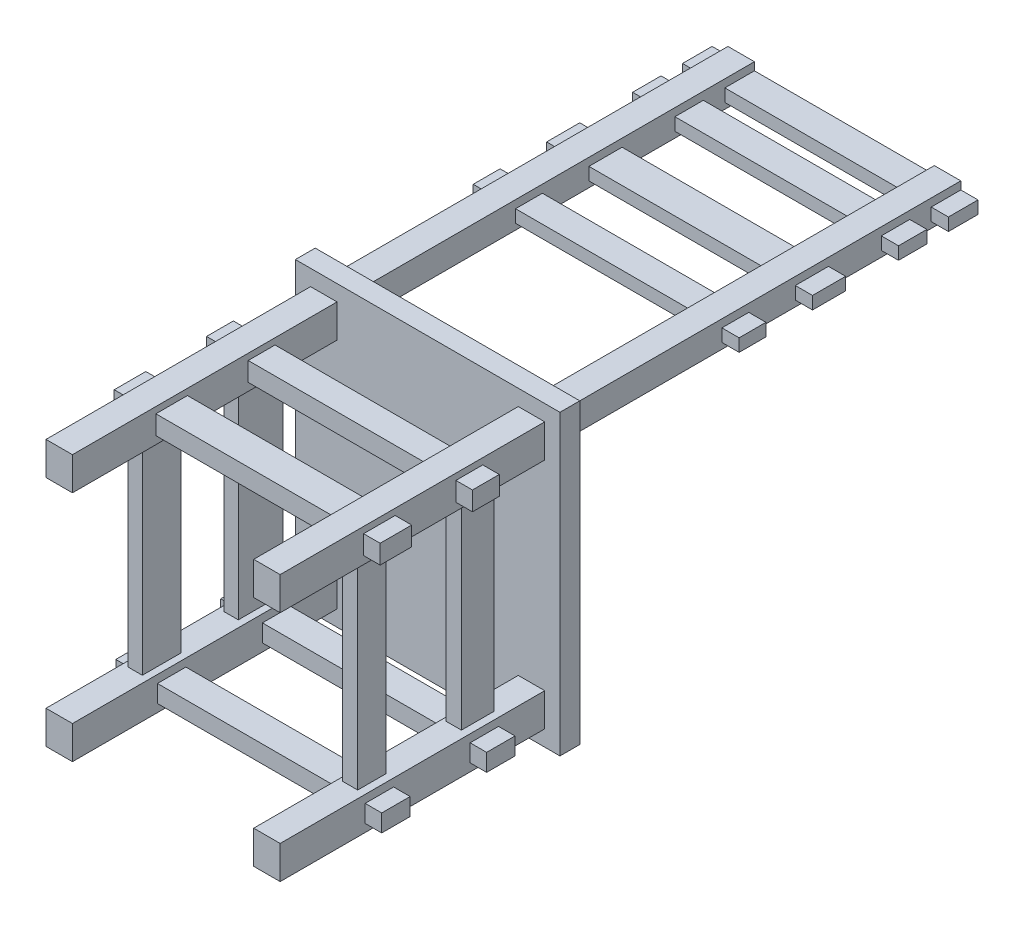
from build123d import *

# Parameters (mm, degrees)
SKETCH2_W                       = 400
SKETCH2_H                       = 450
BOSS_EXTRUDE1_DEPTH             = 30
SKETCH3_W                       = 40
SKETCH3_H                       = 50
BOSS_EXTRUDE2_DEPTH             = 400
SKETCH4_W                       = 40
SKETCH4_H                       = 40
BOSS_EXTRUDE3_DEPTH             = 600
SKETCH5_W                       = 40.556580032
SKETCH5_H                       = 28.62817414
SKETCH5_W_2                     = 47.713623567
BOSS_EXTRUDE4_DEPTH             = 402
SKETCH6_W                       = 42.94226121
SKETCH6_H                       = 26.242492962
SKETCH6_W_2                     = 42.942261211
BOSS_EXTRUDE5_DEPTH             = 402
SKETCH7_W                       = 40.556580032
SKETCH7_H                       = 19.085449427
SKETCH7_W_2                     = 50.099304746
SKETCH7_W_3                     = 42.94226121
SKETCH7_W_4                     = 44.71367334
BOSS_EXTRUDE6_DEPTH             = 402
BOSS_EXTRUDE7_REACH             = 816.236
SKETCH8_W                       = 21.611464792
SKETCH8_H                       = 67.92174649
SKETCH8_H_2                     = 58.65969015
BOSS_EXTRUDE7_DIRECTION_2_DEPTH = 2
BOSS_EXTRUDE8_REACH             = 816.236
SKETCH9_W                       = 23.109912939
SKETCH9_H                       = 42.918409744
SKETCH9_H_2                     = 49.521242012


with BuildPart() as part:
    # Sketch2 → Boss-Extrude1 (new body)
    with BuildSketch(Plane.XY):
        with Locations((200, 225)):
            Rectangle(SKETCH2_W, SKETCH2_H)
    extrude(amount=BOSS_EXTRUDE1_DEPTH)

    # Sketch3 → Boss-Extrude2 (add)
    with BuildSketch(Plane.XY.offset(30)):
        with Locations((43, 401)):
            Rectangle(SKETCH3_W, SKETCH3_H)
        with Locations((357, 401)):
            Rectangle(SKETCH3_W, SKETCH3_H)
        with Locations((357, 49)):
            Rectangle(SKETCH3_W, SKETCH3_H)
        with Locations((43, 49)):
            Rectangle(SKETCH3_W, SKETCH3_H)
    extrude(amount=BOSS_EXTRUDE2_DEPTH)

    # Sketch4 → Boss-Extrude3 (add)
    with BuildSketch(Plane(origin=(0, 0, 0), x_dir=(-1, 0, 0), z_dir=(0, 0, -1))):
        with Locations((-356, 406)):
            Rectangle(SKETCH4_W, SKETCH4_H)
        with Locations((-44, 406)):
            Rectangle(SKETCH4_W, SKETCH4_H)
    extrude(amount=BOSS_EXTRUDE3_DEPTH)

    # Sketch5 → Boss-Extrude4 (add)
    with BuildSketch(Plane(origin=(0, 0, 0), x_dir=(0, 0, -1), z_dir=(1, 0, 0))):
        with Locations((-144.025393122, 402.136827493)):
            Rectangle(SKETCH5_W, SKETCH5_H)
        with Locations((-280.009220289, 402.136827493)):
            Rectangle(SKETCH5_W_2, SKETCH5_H)
    extrude(amount=BOSS_EXTRUDE4_DEPTH)

    # Sketch6 → Boss-Extrude5 (add)
    with BuildSketch(Plane(origin=(0, 0, 0), x_dir=(0, 0, -1), z_dir=(1, 0, 0))):
        with Locations((-280.009220288, 49.056013096)):
            Rectangle(SKETCH6_W, SKETCH6_H)
        with Locations((-121.361421928, 49.056013096)):
            Rectangle(SKETCH6_W_2, SKETCH6_H)
    extrude(amount=BOSS_EXTRUDE5_DEPTH)

    # Sketch7 → Boss-Extrude6 (add)
    with BuildSketch(Plane(origin=(0, 0, 0), x_dir=(0, 0, -1), z_dir=(1, 0, 0))):
        with Locations((259.15472602, 404.522508672)):
            Rectangle(SKETCH7_W, SKETCH7_H)
        with Locations((374.86026317, 404.522508672)):
            Rectangle(SKETCH7_W_2, SKETCH7_H)
        with Locations((501.301365623, 404.522508672)):
            Rectangle(SKETCH7_W_3, SKETCH7_H)
        with Locations((577.64316333, 404.522508672)):
            Rectangle(SKETCH7_W_4, SKETCH7_H)
    extrude(amount=BOSS_EXTRUDE6_DEPTH)

    # Sketch8 → Boss-Extrude7 (add, up to next)
    with BuildSketch(Plane(origin=(0, 74, 0), x_dir=(1, 0, 0), z_dir=(0, 1, 0)), mode=Mode.PRIVATE) as boss_extrude7_sk1:
        with Locations((41.856325516, -134.973838063)):
            Rectangle(SKETCH8_W, SKETCH8_H)
    boss_extrude7_tool1 = extrude(boss_extrude7_sk1.sketch, amount=BOSS_EXTRUDE7_REACH, mode=Mode.PRIVATE) - part.part
    # Sketch8 → Boss-Extrude7 (add, up to next)
    with BuildSketch(Plane(origin=(0, 74, 0), x_dir=(1, 0, 0), z_dir=(0, 1, 0)), mode=Mode.PRIVATE) as boss_extrude7_sk2:
        with Locations((41.856325516, -284.710415551)):
            Rectangle(SKETCH8_W, SKETCH8_H_2)
    boss_extrude7_tool2 = extrude(boss_extrude7_sk2.sketch, amount=BOSS_EXTRUDE7_REACH, mode=Mode.PRIVATE) - part.part
    add(boss_extrude7_tool1.solids().sort_by_distance((41.856326, 74, 134.973838))[0])
    add(boss_extrude7_tool2.solids().sort_by_distance((41.856326, 74, 284.710416))[0])

    # Sketch8 → Boss-Extrude7 direction 2 (add)
    with BuildSketch(Plane(origin=(0, 74, 0), x_dir=(1, 0, 0), z_dir=(0, 1, 0))):
        with Locations((41.856325516, -134.973838063)):
            Rectangle(SKETCH8_W, SKETCH8_H)
        with Locations((41.856325516, -284.710415551)):
            Rectangle(SKETCH8_W, SKETCH8_H_2)
    extrude(amount=-BOSS_EXTRUDE7_DIRECTION_2_DEPTH)

    # Sketch9 → Boss-Extrude8 (add, up to next)
    with BuildSketch(Plane.XZ.offset(-376), mode=Mode.PRIVATE) as boss_extrude8_sk1:
        with Locations((354.146322372, 280.024195097)):
            Rectangle(SKETCH9_W, SKETCH9_H)
    boss_extrude8_tool1 = extrude(boss_extrude8_sk1.sketch, amount=BOSS_EXTRUDE8_REACH, mode=Mode.PRIVATE) - part.part
    # Sketch9 → Boss-Extrude8 (add, up to next)
    with BuildSketch(Plane.XZ.offset(-376), mode=Mode.PRIVATE) as boss_extrude8_sk2:
        with Locations((354.146322372, 119.905512592)):
            Rectangle(SKETCH9_W, SKETCH9_H_2)
    boss_extrude8_tool2 = extrude(boss_extrude8_sk2.sketch, amount=BOSS_EXTRUDE8_REACH, mode=Mode.PRIVATE) - part.part
    add(boss_extrude8_tool1.solids().sort_by_distance((354.146322, 376, 280.024195))[0])
    add(boss_extrude8_tool2.solids().sort_by_distance((354.146322, 376, 119.905513))[0])


solid = part.part
